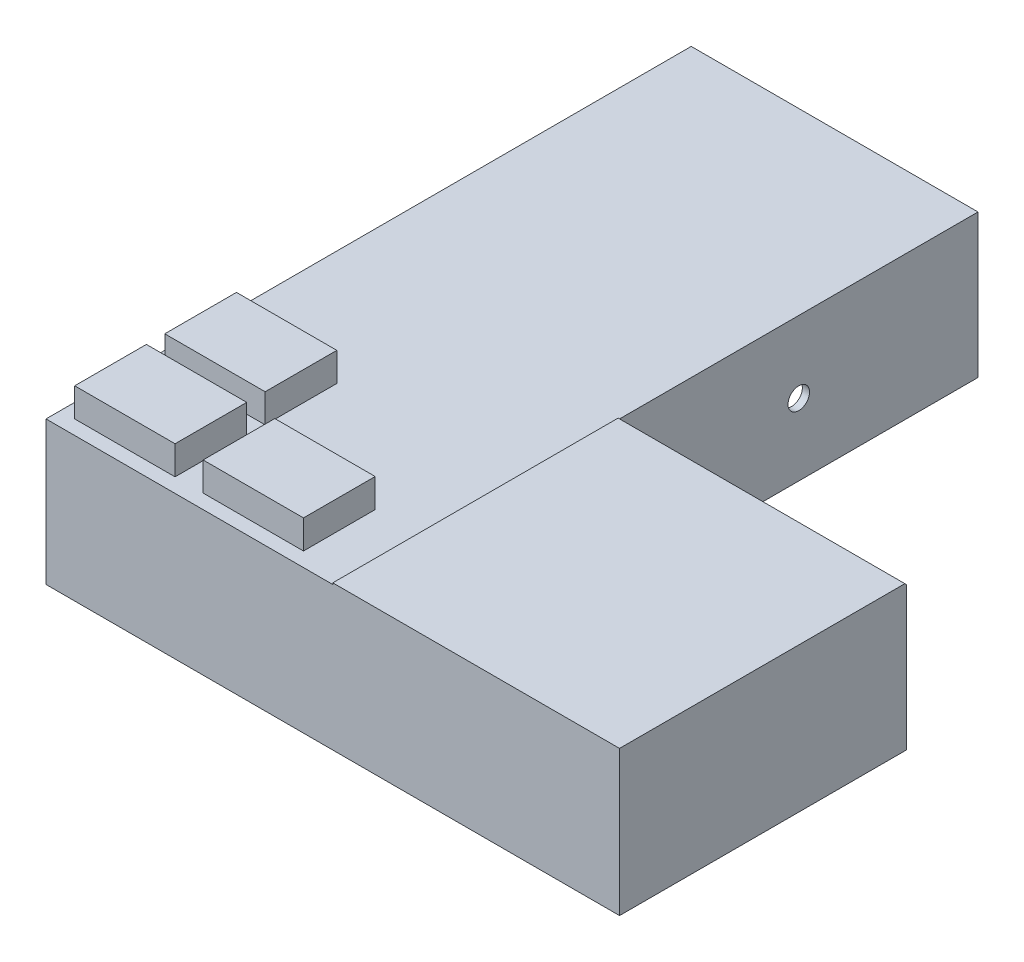
from build123d import *

# Parameters (mm, degrees)
BOSS_EXTRUDE1_DEPTH = 10
SHELL1_T            = -0.5
SKETCH2_R           = 0.75
CUT_EXTRUDE2_DEPTH  = 5
SKETCH3_R           = 0.75
CUT_EXTRUDE3_DEPTH  = 5
SKETCH4_W           = 20
SKETCH4_H           = 20
BOSS_EXTRUDE2_DEPTH = 0.1
CHAMFER1_SIZE       = 0.1
SKETCH5_W           = 7
SKETCH5_H           = 5
BOSS_EXTRUDE3_DEPTH = 2
SKETCH6_W           = 18
SKETCH6_H           = 8
BOSS_EXTRUDE4_DEPTH = 0.5
CUT_EXTRUDE4_DEPTH  = 0.1


with BuildPart() as part:
    # Sketch1 → Boss-Extrude1 (new body)
    with BuildSketch(Plane(origin=(0, 0, 0), x_dir=(1, 0, 0), z_dir=(0, 1, 0))):
        Polygon((0, 0), (0, 25), (-20, 25), (-20, -20), (20, -20), (20, 0), align=None)
    extrude(amount=BOSS_EXTRUDE1_DEPTH)

    # Shell1
    shell1_openings = [part.faces().sort_by_distance(p)[0] for p in [
        (-3.846153846, 0, 1.346153846),
    ]]
    offset(amount=SHELL1_T, openings=shell1_openings, kind=Kind.INTERSECTION)

    # Sketch2 → Cut-Extrude2 (cut)
    with BuildSketch(Plane(origin=(0, 0, 0), x_dir=(-1, 0, 0), z_dir=(0, 0, -1))):
        with Locations((-18, 5)):
            Circle(SKETCH2_R)
        with Locations((-2, 5)):
            Circle(SKETCH2_R)
    extrude(amount=-CUT_EXTRUDE2_DEPTH, mode=Mode.SUBTRACT)

    # Sketch3 → Cut-Extrude3 (cut)
    with BuildSketch(Plane(origin=(0, 0, 0), x_dir=(0, 0, -1), z_dir=(1, 0, 0))):
        with Locations((12.5, 5)):
            Circle(SKETCH3_R)
    extrude(amount=-CUT_EXTRUDE3_DEPTH, mode=Mode.SUBTRACT)

    # Sketch4 → Boss-Extrude2 (add)
    with BuildSketch(Plane(origin=(0, 10, 0), x_dir=(1, 0, 0), z_dir=(0, 1, 0))):
        with Locations((10, -10)):
            Rectangle(SKETCH4_W, SKETCH4_H)
    extrude(amount=BOSS_EXTRUDE2_DEPTH)

    # Chamfer1
    chamfer1_edges = [part.edges().sort_by_distance(p)[0] for p in [
        (10, 10.1, 0),
    ]]
    chamfer(chamfer1_edges, length=CHAMFER1_SIZE)

    # Sketch5 → Boss-Extrude3 (add)
    with BuildSketch(Plane(origin=(0, 10, 0), x_dir=(1, 0, 0), z_dir=(0, 1, 0))):
        with Locations((-15.5, -16.5)):
            Rectangle(SKETCH5_W, SKETCH5_H)
        with Locations((-15.5, -10.217521709)):
            Rectangle(SKETCH5_W, SKETCH5_H)
        with Locations((-6.543184919, -16.5)):
            Rectangle(SKETCH5_W, SKETCH5_H)
    extrude(amount=BOSS_EXTRUDE3_DEPTH)

    # Sketch6 → Boss-Extrude4 (add)
    with BuildSketch(Plane(origin=(0, 0, -25), x_dir=(-1, 0, 0), z_dir=(0, 0, -1))):
        with Locations((10, 5)):
            Rectangle(SKETCH6_W, SKETCH6_H)
    extrude(amount=BOSS_EXTRUDE4_DEPTH)

    # Sketch7 → Cut-Extrude4 (cut)
    # profile 1 of 5: a face of its own
    with BuildSketch(Plane(origin=(0, 0, -25.5), x_dir=(-1, 0, 0), z_dir=(0, 0, -1))):
        with BuildLine():
            Line((2.355986405, 6.507802366), (3.147552912, 6.507802366))
            add(Edge.make_bspline(
                [(3.147552912, 6.507802366), (3.209264625, 6.50737098), (3.328554066, 6.506537106), (3.501380866, 6.497141351), (3.662087797, 6.482691348), (3.810778454, 6.462812749), (3.947147998, 6.436507918), (4.071020583, 6.403513665), (4.182811954, 6.365427288), (4.283747881, 6.320610937), (4.375892674, 6.268359522), (4.463387096, 6.210155642), (4.546059354, 6.143867116), (4.625069621, 6.070772784), (4.699398254, 5.989535407), (4.770283091, 5.90150057), (4.835988548, 5.805391647), (4.898500761, 5.703513026), (4.95503474, 5.595432955), (5.004345788, 5.48207139), (5.045653952, 5.364157855), (5.079218975, 5.241566684), (5.105974172, 5.114704843), (5.124694244, 4.983316336), (5.136267179, 4.847522808), (5.137441156, 4.755488866), (5.138037687, 4.708723841)],
                knots=[0, 0, 0, 0, 1.44355588, 2.790409838, 4.047694926, 5.217575253, 6.298404546, 7.294384826, 8.214239204, 9.058592145, 9.873746385, 10.689560431, 11.514393297, 12.350027578, 13.205127629, 14.088021785, 14.991911688, 15.926770944, 16.882954281, 17.842803888, 18.816321264, 19.80318086, 20.814351908, 21.847355356, 22.906180909, 24, 24, 24, 24], degree=3))
            add(Edge.make_bspline(
                [(5.138037687, 4.708723841), (5.136475647, 4.642735345), (5.13340068, 4.512833129), (5.107498877, 4.322203124), (5.06560689, 4.13946525), (5.006702952, 3.966048955), (4.933677837, 3.803498537), (4.84644116, 3.654680503), (4.746272013, 3.520393634), (4.634337373, 3.401306568), (4.513139421, 3.29894962), (4.387190308, 3.211288385), (4.255263061, 3.142160187), (4.13901672, 3.098322572), (4.038216639, 3.071059367), (3.949715259, 3.054946551), (3.849186721, 3.040170127), (3.735693684, 3.028751224), (3.609734017, 3.018568369), (3.470805645, 3.013035402), (3.319358376, 3.008438328), (3.214163928, 3.008019908), (3.159471982, 3.007802366)],
                knots=[0, 0, 0, 0, 1.315458931, 2.589557908, 3.828601765, 5.048913369, 6.235739168, 7.376350998, 8.481830359, 9.569842114, 10.627874879, 11.640079404, 12.624025415, 13.590060155, 14.111227486, 14.704434459, 15.382649715, 16.137166398, 16.978595427, 17.902333227, 18.909396075, 20, 20, 20, 20], degree=3))
            Line((3.159471982, 3.007802366), (2.355986405, 3.007802366))
            Line((2.355986405, 3.007802366), (2.355986405, 6.507802366))
        make_face()
        with BuildLine():
            Line((2.984191533, 5.879597238), (2.984191533, 3.636007494))
            Line((2.984191533, 3.636007494), (3.312316533, 3.636007494))
            add(Edge.make_bspline(
                [(3.312316533, 3.636007494), (3.351358369, 3.636079035), (3.426448816, 3.636216632), (3.534862425, 3.642770486), (3.635117523, 3.649348748), (3.726938134, 3.661834509), (3.810992497, 3.675742768), (3.886125927, 3.695098015), (3.953887249, 3.715429062), (4.013448774, 3.741313006), (4.068002277, 3.770447106), (4.118512589, 3.804581083), (4.167269183, 3.842485577), (4.213360513, 3.885275413), (4.256961025, 3.932383973), (4.297812751, 3.984053987), (4.336460952, 4.040127808), (4.371913603, 4.100901913), (4.404310425, 4.165734512), (4.433050037, 4.233997609), (4.456879416, 4.306259686), (4.476684936, 4.381844286), (4.490838227, 4.461409456), (4.502547375, 4.544365869), (4.508583782, 4.631042192), (4.509412241, 4.690019658), (4.509832559, 4.719941789)],
                knots=[0, 0, 0, 0, 1.50275155, 2.890291501, 4.180787663, 5.369391935, 6.45668281, 7.458360028, 8.354766181, 9.177074746, 9.954075863, 10.732690366, 11.5210699, 12.329727389, 13.151100085, 13.990027547, 14.863562427, 15.770965086, 16.696477834, 17.652329173, 18.619756807, 19.62365428, 20.657822005, 21.729286259, 22.847956731, 24, 24, 24, 24], degree=3))
            add(Edge.make_bspline(
                [(4.509832559, 4.719941789), (4.508995429, 4.765794626), (4.507363091, 4.855204105), (4.491621171, 4.985430962), (4.46599633, 5.108059058), (4.42943215, 5.222633285), (4.383341869, 5.329475658), (4.325649137, 5.427680995), (4.258836829, 5.518899011), (4.206003478, 5.572410426), (4.179604194, 5.59914852)],
                knots=[0, 0, 0, 0, 1.13821349, 2.219428113, 3.251817212, 4.244760574, 5.201143372, 6.134805572, 7.068016741, 8, 8, 8, 8], degree=3))
            add(Edge.make_bspline(
                [(4.179604194, 5.59914852), (4.153571999, 5.62193299), (4.100404191, 5.668467691), (4.00705899, 5.724228163), (3.904197413, 5.773219203), (3.789466296, 5.812063635), (3.663974464, 5.842783467), (3.526974485, 5.863970184), (3.379200023, 5.877584544), (3.276825319, 5.878911966), (3.223975187, 5.879597238)],
                knots=[0, 0, 0, 0, 0.813307809, 1.661089106, 2.549956539, 3.493439533, 4.508053171, 5.589449661, 6.755572447, 8, 8, 8, 8], degree=3))
            Line((3.223975187, 5.879597238), (2.984191533, 5.879597238))
        make_face(mode=Mode.SUBTRACT)
    # profile 2 of 5: a face of its own
    with BuildSketch(Plane(origin=(0, 0, -25.5), x_dir=(-1, 0, 0), z_dir=(0, 0, -1))):
        with BuildLine():
            add(Edge.make_bspline(
                [(6.895048905, 5.610366469), (6.924749231, 5.609837931), (6.983569334, 5.608791187), (7.071174529, 5.600077999), (7.157248183, 5.585862074), (7.242285036, 5.567454933), (7.325495442, 5.541663775), (7.407315828, 5.510731268), (7.488477774, 5.475217133), (7.566966856, 5.432942891), (7.643350098, 5.38709262), (7.715765958, 5.336516008), (7.783613071, 5.281610319), (7.848150911, 5.223648584), (7.90637191, 5.160107337), (7.961996703, 5.094048263), (8.012020018, 5.023104696), (8.058334401, 4.949005366), (8.099567763, 4.872178774), (8.135371355, 4.793159355), (8.166445507, 4.713039608), (8.190775945, 4.630843619), (8.210919305, 4.547655252), (8.223631196, 4.462455095), (8.23266847, 4.376118367), (8.233681835, 4.317989378), (8.234191533, 4.288751885)],
                knots=[0, 0, 0, 0, 1.022364134, 2.024744242, 3.027414945, 4.024939316, 5.017584196, 6.023349371, 7.035562955, 8.064994934, 9.090267829, 10.101425541, 11.102933353, 12.093946398, 13.084502048, 14.067315274, 15.065326281, 16.070028806, 17.074376865, 18.064572984, 19.055292013, 20.030201733, 21.013838017, 21.999348303, 22.993720005, 24, 24, 24, 24], degree=3))
            add(Edge.make_bspline(
                [(8.234191533, 4.288751885), (8.233653631, 4.259285975), (8.23258416, 4.200701065), (8.223958154, 4.113552234), (8.209687815, 4.02795142), (8.191210026, 3.943394335), (8.165515385, 3.860962966), (8.135493941, 3.779442243), (8.098641436, 3.699943323), (8.057898277, 3.62159895), (8.011286111, 3.546714557), (7.961306098, 3.475060306), (7.905914289, 3.408516025), (7.848159365, 3.345017989), (7.785301879, 3.286713419), (7.718345154, 3.232655604), (7.647868849, 3.182183663), (7.573366166, 3.136481761), (7.495791358, 3.096325131), (7.416452712, 3.060120651), (7.334886297, 3.029977837), (7.251260922, 3.005397202), (7.165525869, 2.986365031), (7.077870419, 2.973436252), (6.988483351, 2.964444434), (6.928257864, 2.963438441), (6.897853392, 2.962930571)],
                knots=[0, 0, 0, 0, 1.012026251, 2.012137606, 3.004615893, 3.992048833, 4.982446996, 5.968083444, 6.973977695, 7.990229942, 8.999482246, 10.001782172, 10.988562221, 11.971415814, 12.948383116, 13.930088534, 14.925840678, 15.924049238, 16.929462851, 17.924729459, 18.917889337, 19.913673841, 20.916777188, 21.931792057, 22.95587778, 24, 24, 24, 24], degree=3))
            add(Edge.make_bspline(
                [(6.897853392, 2.962930571), (6.853395855, 2.964235488), (6.765769373, 2.966807498), (6.636716281, 2.984425094), (6.512738861, 3.014749595), (6.393635093, 3.057021282), (6.279250259, 3.111190873), (6.170582617, 3.178233968), (6.066551221, 3.256830681), (5.968957973, 3.346316705), (5.879549337, 3.444490976), (5.801440136, 3.549291413), (5.735119103, 3.659147232), (5.680645908, 3.774183707), (5.63860371, 3.894558583), (5.608242069, 4.019911982), (5.590602934, 4.150596254), (5.588052677, 4.239386918), (5.586755636, 4.284545155)],
                knots=[0, 0, 0, 0, 1.029999031, 2.030143771, 3.011211297, 3.982305373, 4.953580601, 5.938004764, 6.935448627, 7.970290061, 9.001484052, 10.007591832, 10.993831261, 11.969999897, 12.951306496, 13.942897864, 14.953773953, 16, 16, 16, 16], degree=3))
            add(Edge.make_bspline(
                [(5.586755636, 4.284545155), (5.588097908, 4.332764252), (5.590736118, 4.427537923), (5.611684663, 4.566383511), (5.645137229, 4.699321581), (5.693156281, 4.825980264), (5.754496396, 4.946593164), (5.829378775, 5.060905895), (5.918173492, 5.168944351), (5.986172464, 5.234289712), (6.020750027, 5.267517911)],
                knots=[0, 0, 0, 0, 1.043912699, 2.05178951, 3.033892, 4.007821512, 4.978932272, 5.95884105, 6.962068106, 8, 8, 8, 8], degree=3))
            add(Edge.make_bspline(
                [(6.020750027, 5.267517911), (6.052478397, 5.29506035), (6.115071904, 5.349395881), (6.216765751, 5.418311594), (6.320888775, 5.477833745), (6.428688935, 5.526772023), (6.540466751, 5.563670696), (6.655649424, 5.590529628), (6.774213004, 5.607027171), (6.85456558, 5.609247713), (6.895048905, 5.610366469)],
                knots=[0, 0, 0, 0, 1.048115528, 2.067714963, 3.060638214, 4.039924844, 5.017819947, 5.994373833, 6.98952318, 8, 8, 8, 8], degree=3))
        make_face()
        with BuildLine():
            add(Edge.make_bspline(
                [(6.909071341, 5.027033135), (6.884748962, 5.02622474), (6.836870098, 5.024633405), (6.766391152, 5.016093136), (6.699731423, 4.998589121), (6.635566924, 4.976328804), (6.575032731, 4.946558767), (6.516471029, 4.911720963), (6.462926897, 4.868125738), (6.411809164, 4.820304966), (6.365405656, 4.767201282), (6.325865461, 4.709344858), (6.290535421, 4.648949159), (6.263746443, 4.583803025), (6.241576003, 4.515687087), (6.226571315, 4.443500799), (6.2161291, 4.368050521), (6.215353914, 4.316366564), (6.214960764, 4.290154129)],
                knots=[0, 0, 0, 0, 1.030650113, 2.02884584, 2.99876339, 3.944280128, 4.900564847, 5.851248946, 6.823638398, 7.81794922, 8.81432732, 9.802856497, 10.78262424, 11.771747962, 12.779760563, 13.812642396, 14.89064281, 16, 16, 16, 16], degree=3))
            add(Edge.make_bspline(
                [(6.214960764, 4.290154129), (6.215420803, 4.263017311), (6.216319859, 4.209983613), (6.225629781, 4.132547281), (6.24098215, 4.059060715), (6.262793054, 3.989637437), (6.290223948, 3.923779134), (6.323878475, 3.861855315), (6.364111819, 3.804238306), (6.409726666, 3.750999056), (6.459672976, 3.702673201), (6.514400238, 3.661201759), (6.571616679, 3.625168581), (6.632640878, 3.596228377), (6.696606116, 3.573884192), (6.763702279, 3.55743292), (6.834281958, 3.548569772), (6.882406145, 3.547043096), (6.906967976, 3.546263905)],
                knots=[0, 0, 0, 0, 1.141730614, 2.231293227, 3.276944405, 4.297399982, 5.28939179, 6.275415646, 7.257752684, 8.24146775, 9.222424823, 10.176631434, 11.126518621, 12.063689483, 13.012557477, 13.974037417, 14.965980454, 16, 16, 16, 16], degree=3))
            add(Edge.make_bspline(
                [(6.906967976, 3.546263905), (6.931542091, 3.546955012), (6.979721622, 3.548309985), (7.050384184, 3.558456587), (7.117822989, 3.57442534), (7.182334541, 3.596961834), (7.243397255, 3.626521488), (7.301244887, 3.662727053), (7.356386329, 3.704775325), (7.407002923, 3.754012998), (7.453857736, 3.807418281), (7.494946605, 3.865339447), (7.529282013, 3.927263281), (7.557443196, 3.992800159), (7.579296857, 4.061859999), (7.594395063, 4.13469949), (7.604842861, 4.211092896), (7.605600516, 4.263474915), (7.605986405, 4.290154129)],
                knots=[0, 0, 0, 0, 1.031504075, 2.022346795, 2.991027682, 3.937587355, 4.885570121, 5.833146507, 6.798790848, 7.791235734, 8.792807298, 9.778388351, 10.766749885, 11.760164525, 12.768777521, 13.802286646, 14.880660483, 16, 16, 16, 16], degree=3))
            add(Edge.make_bspline(
                [(7.605986405, 4.290154129), (7.605520514, 4.316824018), (7.604606286, 4.369158993), (7.5952957, 4.445655719), (7.580093996, 4.518259773), (7.558001779, 4.586661139), (7.53073393, 4.651640169), (7.497056142, 4.712864261), (7.456624379, 4.770031869), (7.410787785, 4.822859524), (7.360092749, 4.870507259), (7.306315685, 4.912997471), (7.248226877, 4.948140141), (7.186916105, 4.977110246), (7.122220251, 4.999398606), (7.054211947, 5.015943112), (6.982682768, 5.024680141), (6.933864926, 5.026240607), (6.909071341, 5.027033135)],
                knots=[0, 0, 0, 0, 1.123894411, 2.205445421, 3.243160173, 4.246488011, 5.231014757, 6.210004299, 7.185865357, 8.177612767, 9.153374344, 10.115157457, 11.061423229, 12.009021698, 12.96873347, 13.94135618, 14.954456845, 16, 16, 16, 16], degree=3))
        make_face(mode=Mode.SUBTRACT)
    # profile 3 of 5: a face of its own
    with BuildSketch(Plane(origin=(0, 0, -25.5), x_dir=(-1, 0, 0), z_dir=(0, 0, -1))):
        with BuildLine():
            Line((11.24060179, 5.043860058), (10.720369418, 4.757802366))
            add(Edge.make_bspline(
                [(10.720369418, 4.757802366), (10.696523862, 4.781681589), (10.650686709, 4.82758346), (10.577183149, 4.885687946), (10.504993002, 4.933796844), (10.431140166, 4.969298739), (10.354964484, 4.996035069), (10.273718393, 5.013743128), (10.186453606, 5.025403256), (10.126092454, 5.026478641), (10.094968777, 5.027033135)],
                knots=[0, 0, 0, 0, 1.150764855, 2.212059359, 3.192108068, 4.105322427, 5.000809612, 5.941206042, 6.938435785, 8, 8, 8, 8], degree=3))
            add(Edge.make_bspline(
                [(10.094968777, 5.027033135), (10.066426217, 5.026343727), (10.01057082, 5.024994613), (9.928957221, 5.014917657), (9.851391859, 4.999090601), (9.778013968, 4.975935564), (9.70895424, 4.945346498), (9.643641581, 4.909148941), (9.58271066, 4.865929063), (9.52702275, 4.816301225), (9.476754623, 4.761662076), (9.43191289, 4.703387075), (9.39517692, 4.640611726), (9.363416397, 4.574811478), (9.340065672, 4.504750455), (9.322981714, 4.431064388), (9.313244017, 4.353750013), (9.311833197, 4.300931086), (9.31111461, 4.274028328)],
                knots=[0, 0, 0, 0, 1.121765476, 2.195200973, 3.227634963, 4.230038321, 5.213228299, 6.192116585, 7.160777141, 8.14345191, 9.118668839, 10.075979138, 11.027630062, 11.972829041, 12.943187208, 13.923755399, 14.94248691, 16, 16, 16, 16], degree=3))
            add(Edge.make_bspline(
                [(9.31111461, 4.274028328), (9.311873859, 4.247827643), (9.313356345, 4.196668949), (9.32246424, 4.121504637), (9.338275889, 4.04995142), (9.361983388, 3.982387578), (9.390399475, 3.918190268), (9.426084879, 3.857870065), (9.468048947, 3.801163566), (9.516512605, 3.748563631), (9.570198039, 3.701256444), (9.628075146, 3.6594793), (9.689971246, 3.624060011), (9.756607365, 3.59626383), (9.826897068, 3.573615757), (9.901309754, 3.557489442), (9.979766234, 3.548538222), (10.03324803, 3.547033729), (10.060613809, 3.546263905)],
                knots=[0, 0, 0, 0, 1.070556293, 2.090336998, 3.088792742, 4.058148387, 5.011235098, 5.952916408, 6.915475435, 7.888633318, 8.869583867, 9.83422472, 10.800707077, 11.776204622, 12.778807041, 13.814557445, 14.881744048, 16, 16, 16, 16], degree=3))
            add(Edge.make_bspline(
                [(10.060613809, 3.546263905), (10.094307641, 3.547034918), (10.160073106, 3.548539824), (10.255677005, 3.561303954), (10.345638967, 3.582411337), (10.42996853, 3.611625631), (10.508547717, 3.649823865), (10.581174624, 3.696480158), (10.648595853, 3.751250334), (10.687912199, 3.793950397), (10.707749226, 3.815494674)],
                knots=[0, 0, 0, 0, 1.116373375, 2.178998604, 3.189797796, 4.174590301, 5.13072713, 6.078291395, 7.030403691, 8, 8, 8, 8], degree=3))
            Line((10.707749226, 3.815494674), (11.195729995, 3.480358456))
            add(Edge.make_bspline(
                [(11.195729995, 3.480358456), (11.161905512, 3.439003748), (11.095155466, 3.357393377), (10.978695147, 3.252200588), (10.853348668, 3.161816608), (10.71659504, 3.08967326), (10.570425848, 3.03229245), (10.41369892, 2.991729914), (10.24667935, 2.967852478), (10.131973247, 2.964597431), (10.073234001, 2.962930571)],
                knots=[0, 0, 0, 0, 0.997876357, 1.969233105, 2.924898516, 3.881013542, 4.852507933, 5.855329832, 6.901747111, 8, 8, 8, 8], degree=3))
            add(Edge.make_bspline(
                [(10.073234001, 2.962930571), (10.020365037, 2.964152745), (9.91710612, 2.966539785), (9.766608815, 2.984820005), (9.625058284, 3.015610549), (9.492163337, 3.058372286), (9.368045136, 3.113764747), (9.253106206, 3.182472097), (9.146571287, 3.262583146), (9.050362696, 3.354476335), (8.964522558, 3.454503065), (8.889583808, 3.559847114), (8.824773349, 3.668621026), (8.773929607, 3.782635299), (8.732376257, 3.900112828), (8.704312429, 4.022457889), (8.685802606, 4.148662711), (8.683881619, 4.234231112), (8.682909482, 4.277533937)],
                knots=[0, 0, 0, 0, 1.183377041, 2.311265848, 3.387807024, 4.421911742, 5.431260577, 6.423665966, 7.413571885, 8.409103097, 9.395976332, 10.359992013, 11.300391101, 12.225292883, 13.150239058, 14.085544813, 15.031169026, 16, 16, 16, 16], degree=3))
            add(Edge.make_bspline(
                [(8.682909482, 4.277533937), (8.683430263, 4.307703382), (8.684461769, 4.367459777), (8.69326757, 4.456204687), (8.706966438, 4.543443632), (8.72755422, 4.628564239), (8.752873557, 4.711979483), (8.783652639, 4.793672596), (8.821105508, 4.873222028), (8.862884297, 4.951304474), (8.91050048, 5.025858673), (8.962448749, 5.09685172), (9.018655913, 5.163848816), (9.079782262, 5.226225565), (9.145401587, 5.284428298), (9.214559952, 5.339637842), (9.289495288, 5.389006912), (9.367602553, 5.435422957), (9.449554561, 5.476742177), (9.534409385, 5.512406111), (9.621511288, 5.542707767), (9.711069048, 5.56707091), (9.802698265, 5.587150606), (9.897214277, 5.599894007), (9.993835124, 5.60885107), (10.059190295, 5.60985829), (10.09216429, 5.610366469)],
                knots=[0, 0, 0, 0, 1.00272354, 1.986087015, 2.96193297, 3.936200312, 4.894695956, 5.858592327, 6.835334787, 7.815655071, 8.800643866, 9.773423113, 10.738352213, 11.705312252, 12.673769326, 13.65298065, 14.64420052, 15.654211674, 16.672258995, 17.692438602, 18.712115155, 19.735602823, 20.776372304, 21.827874031, 22.90408564, 24, 24, 24, 24], degree=3))
            add(Edge.make_bspline(
                [(10.09216429, 5.610366469), (10.1227929, 5.610020186), (10.183198997, 5.609337244), (10.272405148, 5.602196133), (10.359177935, 5.590066642), (10.443665032, 5.574019836), (10.526123023, 5.554135049), (10.605446753, 5.527629295), (10.682720712, 5.497546261), (10.782250386, 5.452124022), (10.899577656, 5.384323977), (11.028371564, 5.287083768), (11.143206925, 5.173326905), (11.20796428, 5.087245051), (11.24060179, 5.043860058)],
                knots=[0, 0, 0, 0, 0.826738014, 1.630502179, 2.413926014, 3.191023582, 3.95155221, 4.701751672, 5.446919844, 6.189438973, 7.653650558, 9.094719814, 10.535747635, 12, 12, 12, 12], degree=3))
        make_face()
    # profile 4 of 5: a face of its own
    with BuildSketch(Plane(origin=(0, 0, -25.5), x_dir=(-1, 0, 0), z_dir=(0, 0, -1))):
        Polygon((11.868806918, 6.597545956), (12.497012046, 6.597545956), (12.497012046, 4.503996276), (13.474375828, 5.565494674), (14.250517655, 5.565494674), (13.128021662, 4.346243873), (14.411074546, 3.007802366), (13.620209162, 3.007802366), (12.497012046, 4.179376885), (12.497012046, 3.007802366), (11.868806918, 3.007802366), align=None)
    # profile 5 of 5: a face of its own
    with BuildSketch(Plane(origin=(0, 0, -25.5), x_dir=(-1, 0, 0), z_dir=(0, 0, -1))):
        Polygon((16.506727591, 6.507802366), (17.477781277, 6.507802366), (17.477781277, 3.007802366), (16.849576149, 3.007802366), (16.849576149, 5.924469033), (16.131627431, 5.924469033), align=None)
    extrude(amount=-CUT_EXTRUDE4_DEPTH, mode=Mode.SUBTRACT)


solid = part.part
